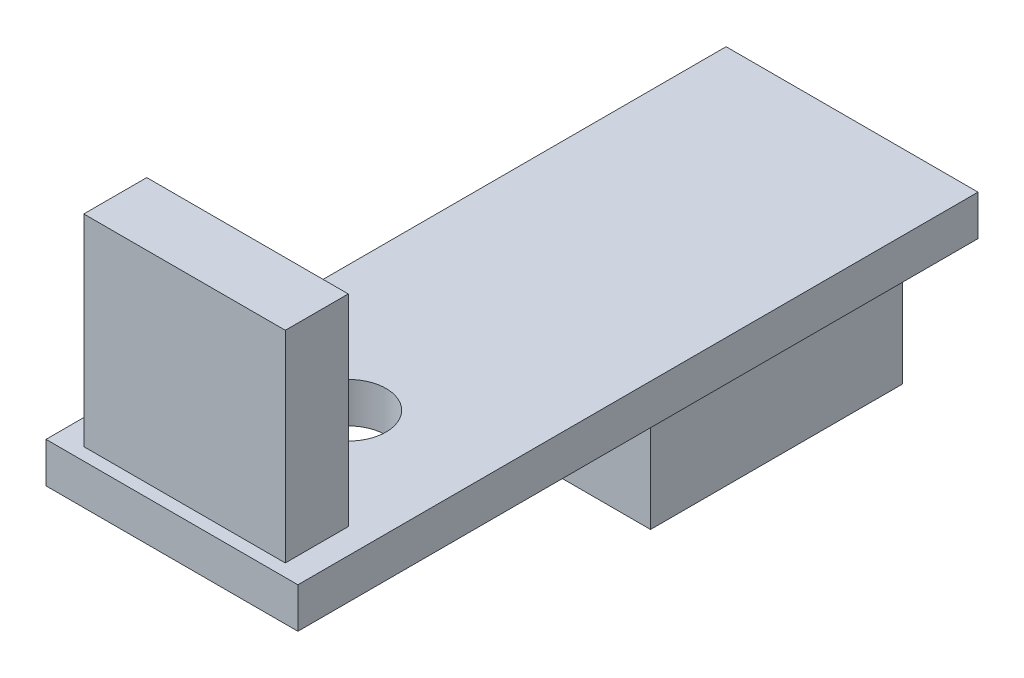
from build123d import *

# Parameters (mm, degrees)
SKETCH_1_W      = 10
SKETCH_1_H      = 27
SKETCH_1_R      = 1.5
EXTRUDE_1_DEPTH = 1.6
SKETCH_2_W      = 8
SKETCH_2_H      = 2.5
EXTRUDE_2_DEPTH = 8
SKETCH_3_W      = 5
SKETCH_3_H      = 10
EXTRUDE_3_DEPTH = 6


with BuildPart() as part:
    # 草图1 → 凸台-拉伸1 (new body)
    with BuildSketch(Plane(origin=(0, 0, 0), x_dir=(1, 0, 0), z_dir=(0, 1, 0))):
        with Locations((0, 6.5)):
            Rectangle(SKETCH_1_W, SKETCH_1_H)
        with Locations(Location((0, 0, 0), (0, 0, 270))):
            Circle(SKETCH_1_R, mode=Mode.SUBTRACT)
    extrude(amount=EXTRUDE_1_DEPTH)

    # 草图2 → 凸台-拉伸2 (add)
    with BuildSketch(Plane(origin=(0, 1.6, 0), x_dir=(1, 0, 0), z_dir=(0, 1, 0))):
        with Locations((0, -5.25)):
            Rectangle(SKETCH_2_W, SKETCH_2_H)
    extrude(amount=EXTRUDE_2_DEPTH)

    # 草图3 → 凸台-拉伸3 (add)
    with BuildSketch(Plane.XZ):
        with Locations((0, -14.5)):
            Rectangle(SKETCH_3_W, SKETCH_3_H)
    extrude(amount=EXTRUDE_3_DEPTH)


solid = part.part
